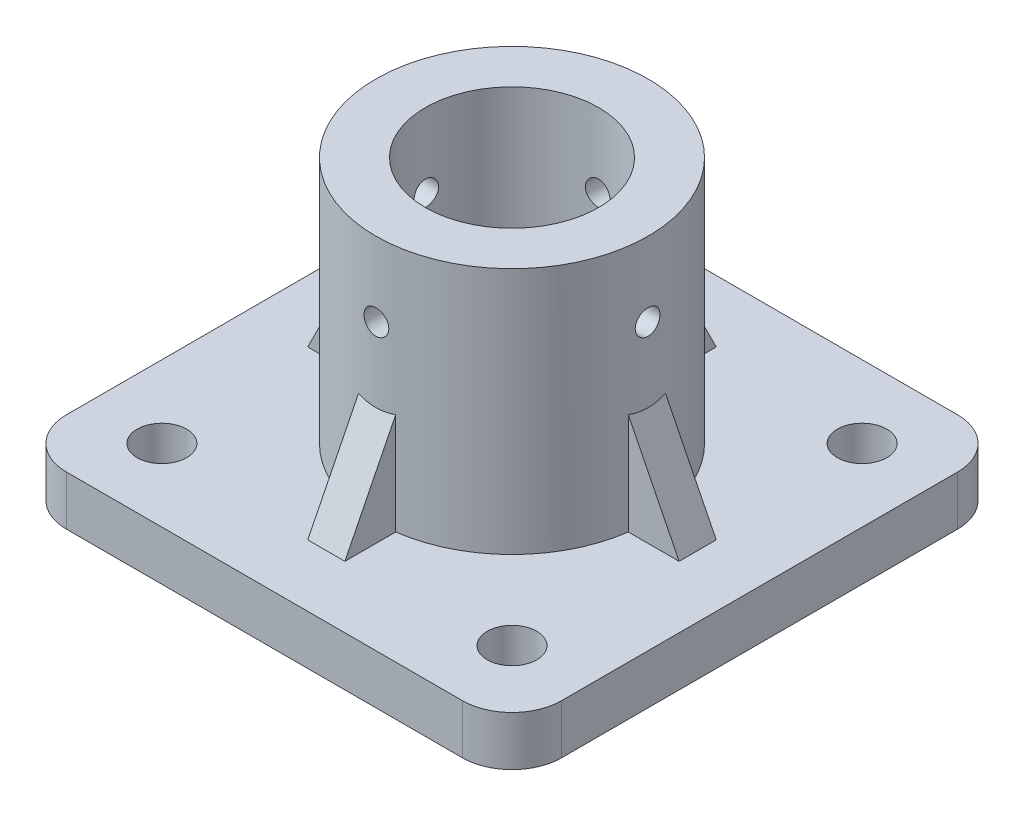
from build123d import *

# Parameters (mm, degrees)
SKETCH2_R           = 10
SKETCH2_R_2         = 35
BOSS_EXTRUDE1_DEPTH = 20
SKETCH5_R           = 55
SKETCH5_R_2         = 35
BOSS_EXTRUDE2_DEPTH = 100
RIB1_REACH          = 187.472
SKETCH6_WALL_W      = 417.66609937
SKETCH6_WALL_H      = 15
CIRPATTERN1_COUNT   = 4
SKETCH7_R           = 5
CUT_EXTRUDE2_DEPTH  = 186.47236991
CIRPATTERN2_COUNT   = 4


with BuildPart() as part:
    # Sketch2 → Boss-Extrude1 (new body)
    with BuildSketch(Plane(origin=(0, 0, 0), x_dir=(1, 0, 0), z_dir=(0, 1, 0))):
        with BuildLine():
            Line((-80, -100), (80, -100))
            ThreePointArc((80, -100), (94.142135624, -94.142135624), (100, -80))
            Line((100, -80), (100, 80))
            ThreePointArc((100, 80), (94.142135624, 94.142135624), (80, 100))
            Line((80, 100), (-80, 100))
            ThreePointArc((-80, 100), (-94.142135624, 94.142135624), (-100, 80))
            Line((-100, 80), (-100, -80))
            ThreePointArc((-100, -80), (-94.142135624, -94.142135624), (-80, -100))
        make_face()
        with Locations(Location((-70.710678119, 70.710678119, 0), (0, 0, 270))):
            Circle(SKETCH2_R, mode=Mode.SUBTRACT)
        with Locations(Location((70.710678119, 70.710678119, 0), (0, 0, 270))):
            Circle(SKETCH2_R, mode=Mode.SUBTRACT)
        with Locations(Location((-70.710678119, -70.710678119, 0), (0, 0, 270))):
            Circle(SKETCH2_R, mode=Mode.SUBTRACT)
        with Locations(Location((70.710678119, -70.710678119, 0), (0, 0, 270))):
            Circle(SKETCH2_R, mode=Mode.SUBTRACT)
        with Locations(Location((0, 0, 0), (0, 0, 270))):
            Circle(SKETCH2_R_2, mode=Mode.SUBTRACT)
    extrude(amount=BOSS_EXTRUDE1_DEPTH)

    # Sketch5 → Boss-Extrude2 (add)
    with BuildSketch(Plane(origin=(0, 20, 0), x_dir=(1, 0, 0), z_dir=(0, 1, 0))):
        with Locations(Location((0, 0, 0), (0, 0, 90))):
            Circle(SKETCH5_R)
        with Locations(Location((0, 0, 0), (0, 0, 270))):
            Circle(SKETCH5_R_2, mode=Mode.SUBTRACT)
    extrude(amount=BOSS_EXTRUDE2_DEPTH)

    # Sketch6 wall → Rib1 (add, up to next)
    with BuildSketch(Plane(origin=(65, 40, 0), x_dir=(0.4472135955, -0.894427191, 0), z_dir=(0.894427191, 0.4472135955, 0)), mode=Mode.PRIVATE) as rib1_sk1:
        Rectangle(SKETCH6_WALL_W, SKETCH6_WALL_H)
    rib1_tool1 = extrude(rib1_sk1.sketch, amount=-RIB1_REACH, mode=Mode.PRIVATE) - part.part
    rib1 = rib1_tool1.solids().sort_by_distance((65, 40, 0))[0]
    add(rib1)

    # CirPattern1: Rib1 ×4 about axis
    cirpattern1_axis = Axis((0, 0, 0), (0, 1, 0))
    for i in range(1, CIRPATTERN1_COUNT):
        add(rib1.rotate(cirpattern1_axis, i * 360 / CIRPATTERN1_COUNT))

    # Sketch7 → Cut-Extrude2 (cut, through all)
    with BuildSketch(Plane.XY):
        with Locations(Location((0, 90, 0), (0, 0, 90))):
            Circle(SKETCH7_R)
    cut_extrude2 = extrude(amount=-CUT_EXTRUDE2_DEPTH, mode=Mode.SUBTRACT)

    # CirPattern2: Cut-Extrude2 ×4 about axis
    cirpattern2_axis = Axis((0, 0, 0), (0, -1, 0))
    for i in range(1, CIRPATTERN2_COUNT):
        add(cut_extrude2.rotate(cirpattern2_axis, i * 360 / CIRPATTERN2_COUNT), mode=Mode.SUBTRACT)


solid = part.part
